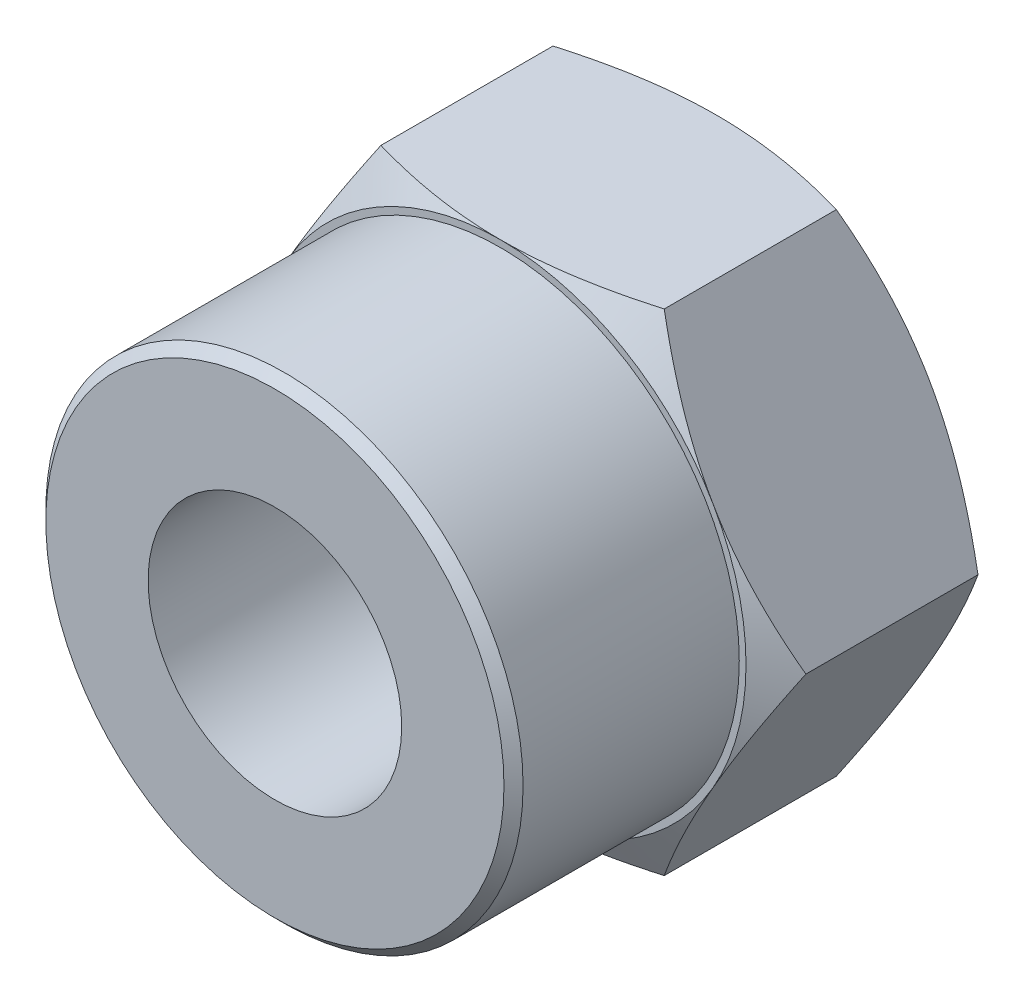
from build123d import *

# Parameters (mm, degrees)
SKETCH1_R      = 2.067
BASENUT_DEPTH  = 3.52
EXTRUDE1_START = 3.68
SKETCH2_R      = 3.89
SKETCH2_R_2    = 2.067
EXTRUDE1_DEPTH = 3.68
CHAMFER1_SIZE  = 0.1556


with BuildPart() as part:
    # Sketch1 → BaseNut (new body)
    with BuildSketch(Plane.XY):
        Polygon((2.309401077, -4), (4.618802154, 0), (2.309401077, 4), (-2.309401077, 4), (-4.618802154, 0), (-2.309401077, -4), align=None)
        Circle(SKETCH1_R, mode=Mode.SUBTRACT)
    extrude(amount=-BASENUT_DEPTH)

    # Sketch3 → Double-Chamfer (revolve, cut)
    with BuildSketch(Plane(origin=(0, 0, 0), x_dir=(1, 0, 0), z_dir=(0, 1, 0))):
        Polygon((4, 3.52), (4.618802154, 3.52), (4.618802154, 3.16273441), align=None)
        Polygon((4.618802154, 0.35726559), (4, 0), (4.618802154, 0), align=None)
    revolve(axis=Axis((0, 0, -16.31077227), (0, 0, 1)), mode=Mode.SUBTRACT)

    # Sketch2 → Extrude1 (add)
    with BuildSketch(Plane(origin=(19.181370739, 9.516836059, 0), x_dir=(1, 0, 0), z_dir=(0, 0, 1)).offset(EXTRUDE1_START)):
        with Locations((-19.181370739, -9.516836059)):
            Circle(SKETCH2_R)
        with Locations((-19.181370739, -9.516836059)):
            Circle(SKETCH2_R_2, mode=Mode.SUBTRACT)
    extrude(amount=-EXTRUDE1_DEPTH)

    # Sketch5 → EndChamfer (revolve, cut)
    with BuildSketch(Plane(origin=(0, 0, 0), x_dir=(1, 0, 0), z_dir=(0, 1, 0))):
        Polygon((2.067, 3.52), (2.875, 3.52), (2.067, 3.053500982), align=None)
    revolve(axis=Axis((0, 0, -16.800797033), (0, 0, 1)), mode=Mode.SUBTRACT)

    # Chamfer1
    chamfer1_edges = [part.edges().sort_by_distance(p)[0] for p in [
        (-3.89, 0, 3.68),
    ]]
    chamfer(chamfer1_edges, length=CHAMFER1_SIZE)


solid = part.part
